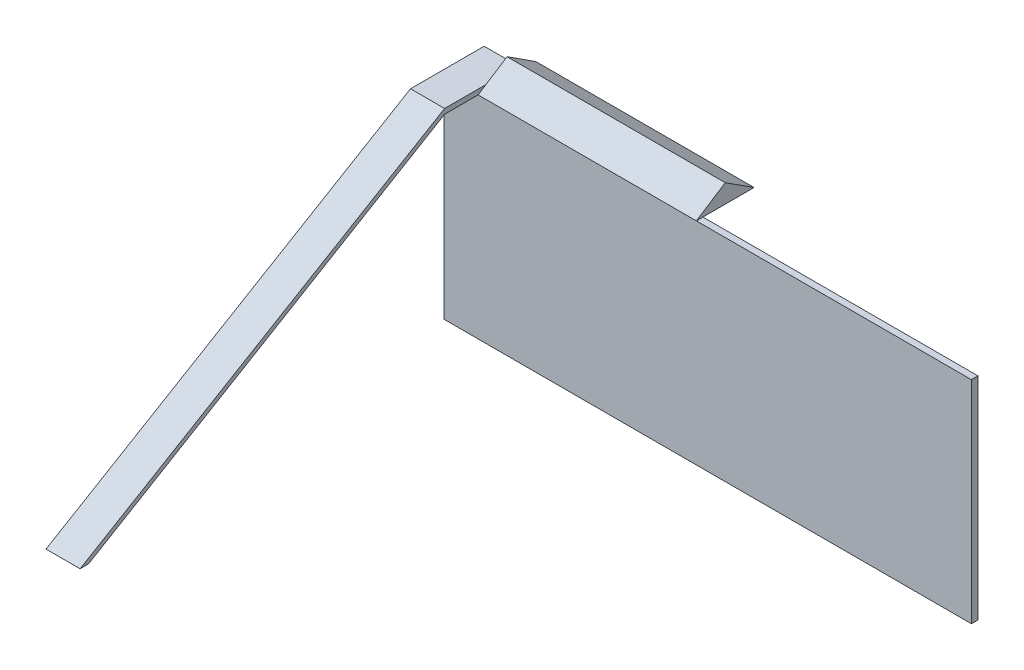
from build123d import *

# Parameters (mm, degrees)
SKETCH1_W           = 2170
SKETCH1_H           = 930
SKETCH1_W_2         = 150
BOSS_EXTRUDE1_DEPTH = 29
BOSS_EXTRUDE2_DEPTH = 150
BOSS_EXTRUDE3_DEPTH = 960


with BuildPart() as part:
    # Sketch1 → Boss-Extrude1 (new body)
    with BuildSketch(Plane.XY):
        with Locations((1085, 465)):
            Rectangle(SKETCH1_W, SKETCH1_H)
        with Locations((-75, 465)):
            Rectangle(SKETCH1_W_2, SKETCH1_H)
    extrude(amount=-BOSS_EXTRUDE1_DEPTH)

    # Sketch2 → Boss-Extrude2 (add)
    with BuildSketch(Plane.ZY.offset(150)):
        Polygon((0, 930), (147.5, 930), (147.5, 952.096276874), (-176.5, 952.096276874), (-176.5, 930), (-29, 930), align=None)
        Polygon((1751.163829973, 0), (147.5, 952.096276874), (147.5, 930), (1713.945955204, 0), align=None)
    extrude(amount=-BOSS_EXTRUDE2_DEPTH)

    # Sketch3 → Boss-Extrude3 (add)
    with BuildSketch(Plane(origin=(0, 0, 0), x_dir=(0, 0, -1), z_dir=(1, 0, 0))):
        Polygon((0, 930), (254, 930), (127, 1012), align=None)
    extrude(amount=BOSS_EXTRUDE3_DEPTH)


solid = part.part
